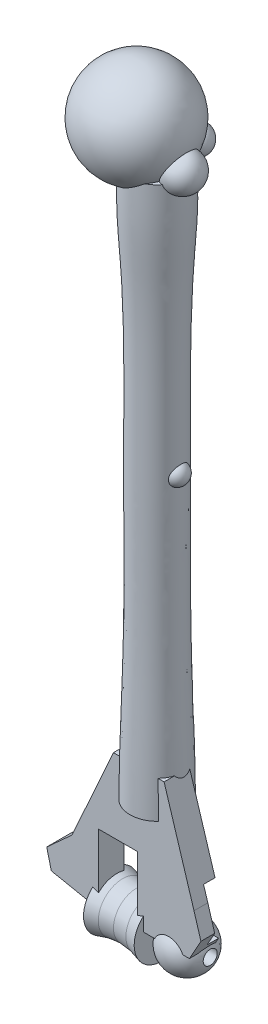
from build123d import *

# Parameters (mm, degrees)
PALETA_DISTAL_DEPTH    = 11
SKETCH7_W              = 17
SKETCH7_H              = 32
FOSA_OLECRANEANA_DEPTH = 13
SKETCH8_W              = 27
SKETCH8_H              = 22
FOSA_RADIAL_DEPTH      = 6
SKETCH11_R             = 3.05
AGUJERO_EJE_CODO_DEPTH = 1000


with BuildPart() as part:
    # Sketch1 → Diafisis (revolve)
    with BuildSketch(Plane.XY):
        with BuildLine():
            Line((20.8, -252), (9, -252))
            Line((9, -252), (9, -12))
            Line((9, -12), (21.5, -12))
            add(Edge.make_bspline(
                [(21.5, -12), (21.542662415, -18.002311616), (21.637544488, -31.351573684), (18.850268066, -67.285299829), (19.625588592, -124.010418346), (18.861085964, -186.01295117), (20.537311096, -229.996046734), (20.744285943, -247.333150759), (20.8, -252)],
                knots=[0, 0, 0, 0, 0.07498426, 0.166766506, 0.450060816, 0.783321394, 0.941673858, 1, 1, 1, 1], degree=3))
        make_face()
    revolve(axis=Axis((9, -256, 0), (0, 1, 0)))

    # Sketch2 → Cabeza_humeral (revolve)
    with BuildSketch(Plane.XY):
        with BuildLine():
            Line((0, -22), (0, 22))
            ThreePointArc((0, 22), (22, 0), (0, -22))
        make_face()
    revolve(axis=Axis((0, -26, 0), (0, 1, 0)))

    # Sketch3 → Tuberculo_mayor (revolve)
    with BuildSketch(Plane.XY):
        with BuildLine():
            Line((20, -18), (20, -2))
            ThreePointArc((20, -2), (28, -10), (20, -18))
        make_face()
    revolve(axis=Axis((20, -22, 0), (0, 1, 0)))

    # Sketch4 → Tuberculo_menor (revolve)
    with BuildSketch(Plane.XY.offset(-17)):
        with BuildLine():
            Line((9, -18), (9, -6))
            ThreePointArc((9, -6), (15, -12), (9, -18))
        make_face()
    revolve(axis=Axis((9, -22, -17), (0, 1, 0)))

    # Sketch5 → Tuberosidad_deltoidea (revolve)
    with BuildSketch(Plane.XY):
        with BuildLine():
            Line((17.5, -129.5), (17.5, -120.5))
            ThreePointArc((17.5, -120.5), (22, -125), (17.5, -129.5))
        make_face()
    revolve(axis=Axis((17.5, -133.5, 0), (0, 1, 0)))

    # Sketch6 → Paleta_distal (add)
    with BuildSketch(Plane.XY.offset(-3)):
        Polygon((-2, -236), (20, -236), (33, -278), (36, -288), (31, -297), (-14, -297), (-29, -294), (-31, -286), (-20, -276), align=None)
    extrude(amount=PALETA_DISTAL_DEPTH)

    # Sketch7 → Fosa_olecraneana (cut)
    with BuildSketch(Plane.XY.offset(-4)):
        with Locations((0, -284)):
            Rectangle(SKETCH7_W, SKETCH7_H)
    extrude(amount=FOSA_OLECRANEANA_DEPTH, mode=Mode.SUBTRACT)

    # Sketch8 → Fosa_radial (cut)
    with BuildSketch(Plane.XY.offset(-4)):
        with Locations((23, -283)):
            Rectangle(SKETCH8_W, SKETCH8_H)
    extrude(amount=FOSA_RADIAL_DEPTH, mode=Mode.SUBTRACT)

    # Sketch9 → Troclea (revolve)
    with BuildSketch(Plane.XY, mode=Mode.PRIVATE) as troclea_sk:
        Polygon((-11, -300), (-11, -288), (-6, -289.4), (0, -290), (6, -289.4), (11, -288), (11, -300), align=None)
    revolve(troclea_sk.sketch.rotate(Axis((-15, -300, 0), (1, 0, 0)), 90), axis=Axis((-15, -300, 0), (1, 0, 0)))

    # Sketch10 → Capitulo (revolve)
    with BuildSketch(Plane.XY):
        with BuildLine():
            Line((22, -310.5), (22, -289.5))
            ThreePointArc((22, -289.5), (32.5, -300), (22, -310.5))
        make_face()
    revolve(axis=Axis((22, -314.5, 0), (0, 1, 0)))

    # Sketch11 → Agujero_eje_codo (cut, symmetric)
    with BuildSketch(Plane(origin=(0, 0, 0), x_dir=(0, 0, -1), z_dir=(1, 0, 0))):
        with Locations(Location((0, -300, 0), (0, 0, 79.611142185))):
            Circle(SKETCH11_R)
    extrude(amount=AGUJERO_EJE_CODO_DEPTH, both=True, mode=Mode.SUBTRACT)


solid = part.part
